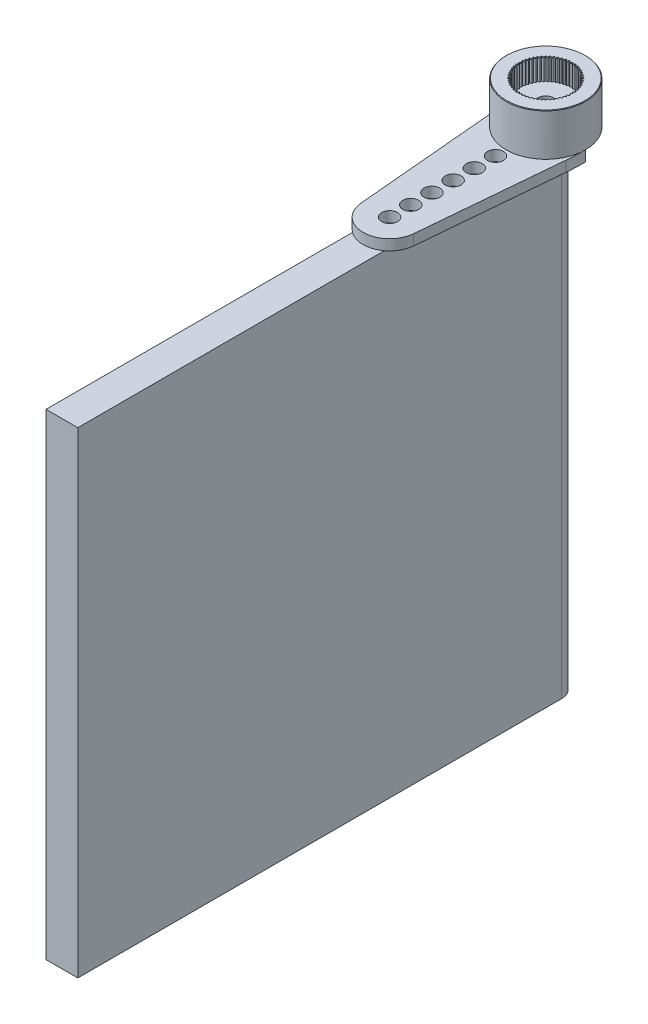
from build123d import *

# Parameters (mm, degrees)
IZIM1_R                     = 0.75
IZIM1_R_2                   = 3.75
Y_KSEKLIK_EKSTR_ZYON1_DEPTH = 1
IZIM2_R                     = 1.5
KES_EKSTR_ZYON1_DEPTH       = 1
IZIM2_3_R                   = 3.75
Y_KSEKLIK_EKSTR_ZYON2_DEPTH = 4
IZIM1_5_R                   = 0.75
KES_EKSTR_ZYON2_DEPTH       = 19.347343132
KES_EKSTR_ZYON3_START       = -2
IZIM3_R                     = 0.75
KES_EKSTR_ZYON3_DEPTH       = 2
PAH1_SIZE                   = 0.05
CORTAR_EXTRUIR1_DEPTH       = 1
SALIENTE_EXTRUIR7_DEPTH     = 45


with BuildPart() as part:
    # Çizim1 → Yükseklik-Ekstrüzyon1 (new body)
    # profile 1 of 3: a face of its own
    with BuildSketch(Plane(origin=(0, 0, 0), x_dir=(1, 0, 0), z_dir=(0, 1, 0))):
        with BuildLine():
            ThreePointArc((3.75, 0), (5e-09, -3.75), (-3.75, -1e-08))
            ThreePointArc((-3.75, -1e-08), (-3.730089845, -0.892193815), (-3.670399021, -1.782611249))
            Line((-3.670399021, -1.782611249), (-2.490049878, -14.972826406))
            ThreePointArc((-2.490049878, -14.972826406), (0, -17.25), (2.490049878, -14.972826406))
            Line((2.490049878, -14.972826406), (3.670399021, -1.782611249))
            ThreePointArc((3.670399021, -1.782611249), (3.730089845, -0.89219381), (3.75, 0))
        make_face()
        with Locations(Location((0, -14.75, 0), (0, 0, 270))):
            Circle(IZIM1_R, mode=Mode.SUBTRACT)
        with Locations(Location((0, -12.75, 0), (0, 0, 270))):
            Circle(IZIM1_R, mode=Mode.SUBTRACT)
        with Locations(Location((0, -10.75, 0), (0, 0, 270))):
            Circle(IZIM1_R, mode=Mode.SUBTRACT)
        with Locations(Location((0, -8.75, 0), (0, 0, 270))):
            Circle(IZIM1_R, mode=Mode.SUBTRACT)
        with Locations(Location((0, -6.75, 0), (0, 0, 270))):
            Circle(IZIM1_R, mode=Mode.SUBTRACT)
        with Locations(Location((0, -4.75, 0), (0, 0, 270))):
            Circle(IZIM1_R, mode=Mode.SUBTRACT)
    # profile 2 of 3: a face of its own
    with BuildSketch(Plane(origin=(0, 0, 0), x_dir=(1, 0, 0), z_dir=(0, 1, 0))):
        Circle(IZIM1_R_2)
        with Locations(Location((0, 0, 0), (0, 0, 270))):
            Circle(IZIM1_R, mode=Mode.SUBTRACT)
    # profile 3 of 3: a face of its own
    with BuildSketch(Plane(origin=(0, 0, 0), x_dir=(1, 0, 0), z_dir=(0, 1, 0))):
        with BuildLine():
            Line((-2.490049878, 14.972826406), (-3.670399021, 1.782611249))
            ThreePointArc((-3.670399021, 1.782611249), (-3.730089845, 0.892193805), (-3.75, -1e-08))
            ThreePointArc((-3.75, -1e-08), (-5e-09, 3.75), (3.75, 0))
            ThreePointArc((3.75, 0), (3.730089845, 0.89219381), (3.670399021, 1.782611249))
            Line((3.670399021, 1.782611249), (2.490049878, 14.972826406))
            ThreePointArc((2.490049878, 14.972826406), (0, 17.25), (-2.490049878, 14.972826406))
        make_face()
        with Locations(Location((0, 4.75, 0), (0, 0, 270))):
            Circle(IZIM1_R, mode=Mode.SUBTRACT)
        with Locations(Location((0, 6.75, 0), (0, 0, 270))):
            Circle(IZIM1_R, mode=Mode.SUBTRACT)
        with Locations(Location((0, 8.75, 0), (0, 0, 270))):
            Circle(IZIM1_R, mode=Mode.SUBTRACT)
        with Locations(Location((0, 10.75, 0), (0, 0, 270))):
            Circle(IZIM1_R, mode=Mode.SUBTRACT)
        with Locations(Location((0, 12.75, 0), (0, 0, 270))):
            Circle(IZIM1_R, mode=Mode.SUBTRACT)
        with Locations(Location((0, 14.75, 0), (0, 0, 270))):
            Circle(IZIM1_R, mode=Mode.SUBTRACT)
    extrude(amount=Y_KSEKLIK_EKSTR_ZYON1_DEPTH)

    # Çizim2 → Kes-Ekstrüzyon1 (cut)
    with BuildSketch(Plane(origin=(0, 1, 0), x_dir=(1, 0, 0), z_dir=(0, 1, 0))):
        with Locations(Location((0, 0, 0), (0, 0, 270))):
            Circle(IZIM2_R)
    extrude(amount=-KES_EKSTR_ZYON1_DEPTH, mode=Mode.SUBTRACT)

    # Çizim2<3> → Yükseklik-Ekstrüzyon2 (add)
    with BuildSketch(Plane(origin=(0, 1, 0), x_dir=(1, 0, 0), z_dir=(0, 1, 0))):
        with Locations(Location((0, 0, 0), (0, 0, 180))):
            Circle(IZIM2_3_R)
    extrude(amount=Y_KSEKLIK_EKSTR_ZYON2_DEPTH)

    # Çizim1<5> → Kes-Ekstrüzyon2 (cut, through all)
    with BuildSketch(Plane(origin=(0, 0, 0), x_dir=(1, 0, 0), z_dir=(0, 1, 0))):
        with Locations(Location((0, 0, 0), (0, 0, 270))):
            Circle(IZIM1_5_R)
    extrude(amount=KES_EKSTR_ZYON2_DEPTH, mode=Mode.SUBTRACT)

    # Çizim3 → Kes-Ekstrüzyon3 (cut)
    with BuildSketch(Plane(origin=(0, 5, 0), x_dir=(1, 0, 0), z_dir=(0, 1, 0)).offset(KES_EKSTR_ZYON3_START)):
        Polygon((0.132931704, 2.367068296), (0, 2.5), (-0.132931704, 2.367068296), (-0.27991119, 2.484280525), (-0.397123419, 2.337301039), (-0.556302335, 2.43731978), (-0.656321077, 2.278140865), (-0.825697655, 2.359708326), (-0.907265116, 2.190331748), (-1.084709348, 2.25242217), (-1.14679977, 2.074977938), (-1.330080191, 2.116810498), (-1.371912751, 1.933530077), (-1.558724505, 1.954578706), (-1.579773134, 1.767766953), (-1.767766953, 1.767766953), (-1.767766953, 1.579773134), (-1.954578706, 1.558724505), (-1.933530077, 1.371912751), (-2.116810498, 1.330080191), (-2.074977938, 1.14679977), (-2.25242217, 1.084709348), (-2.190331748, 0.907265116), (-2.359708326, 0.825697655), (-2.278140865, 0.656321077), (-2.43731978, 0.556302335), (-2.337301039, 0.397123419), (-2.484280525, 0.27991119), (-2.367068296, 0.132931704), (-2.5, 0), (-2.367068296, -0.132931704), (-2.484280525, -0.27991119), (-2.337301039, -0.397123419), (-2.43731978, -0.556302335), (-2.278140865, -0.656321077), (-2.359708326, -0.825697655), (-2.190331748, -0.907265116), (-2.25242217, -1.084709348), (-2.074977938, -1.14679977), (-2.116810498, -1.330080191), (-1.933530077, -1.371912751), (-1.954578706, -1.558724505), (-1.767766953, -1.579773134), (-1.767766953, -1.767766953), (-1.579773134, -1.767766953), (-1.558724505, -1.954578706), (-1.371912751, -1.933530077), (-1.330080191, -2.116810498), (-1.14679977, -2.074977938), (-1.084709348, -2.25242217), (-0.907265116, -2.190331748), (-0.825697655, -2.359708326), (-0.656321077, -2.278140865), (-0.556302335, -2.43731978), (-0.397123419, -2.337301039), (-0.27991119, -2.484280525), (-0.132931704, -2.367068296), (0, -2.5), (0.132931704, -2.367068296), (0.27991119, -2.484280525), (0.397123419, -2.337301039), (0.556302335, -2.43731978), (0.656321077, -2.278140865), (0.825697655, -2.359708326), (0.907265116, -2.190331748), (1.084709348, -2.25242217), (1.14679977, -2.074977938), (1.330080191, -2.116810498), (1.371912751, -1.933530077), (1.558724505, -1.954578706), (1.579773134, -1.767766953), (1.767766953, -1.767766953), (1.767766953, -1.579773134), (1.954578706, -1.558724505), (1.933530077, -1.371912751), (2.116810498, -1.330080191), (2.074977938, -1.14679977), (2.25242217, -1.084709348), (2.190331748, -0.907265116), (2.359708326, -0.825697655), (2.278140865, -0.656321077), (2.43731978, -0.556302335), (2.337301039, -0.397123419), (2.484280525, -0.27991119), (2.367068296, -0.132931704), (2.5, 0), (2.367068296, 0.132931704), (2.484280525, 0.27991119), (2.337301039, 0.397123419), (2.43731978, 0.556302335), (2.278140865, 0.656321077), (2.359708326, 0.825697655), (2.190331748, 0.907265116), (2.25242217, 1.084709348), (2.074977938, 1.14679977), (2.116810498, 1.330080191), (1.933530077, 1.371912751), (1.954578706, 1.558724505), (1.767766953, 1.579773134), (1.767766953, 1.767766953), (1.579773134, 1.767766953), (1.558724505, 1.954578706), (1.371912751, 1.933530077), (1.330080191, 2.116810498), (1.14679977, 2.074977938), (1.084709348, 2.25242217), (0.907265116, 2.190331748), (0.825697655, 2.359708326), (0.656321077, 2.278140865), (0.556302335, 2.43731978), (0.397123419, 2.337301039), (0.27991119, 2.484280525), align=None)
        Circle(IZIM3_R, mode=Mode.SUBTRACT)
    extrude(amount=KES_EKSTR_ZYON3_DEPTH, mode=Mode.SUBTRACT)

    # Pah1
    pah1_edges = [part.edges().sort_by_distance(p)[0] for p in [
        (-0.206421447, 5, -2.42567441),
        (0.066465852, 5, -2.433534148),
        (0.338517305, 5, -2.410790782),
        (0.606311706, 5, -2.357730323),
        (0.866481385, 5, -2.275020037),
        (1.115754559, 5, -2.163700054),
        (1.350996471, 5, -2.025170287),
        (1.569248819, 5, -1.86117283),
        (1.767766953, 5, -1.673770044),
        (1.944054391, 5, -1.465318628),
        (2.095894218, 5, -1.238439981),
        (2.221376959, 5, -0.995987232),
        (2.318924595, 5, -0.741009366),
        (2.38731041, 5, -0.476712877),
        (2.42567441, 5, -0.206421447),
        (2.433534148, 5, 0.066465852),
        (2.410790782, 5, 0.338517305),
        (2.357730323, 5, 0.606311706),
        (2.275020037, 5, 0.866481385),
        (2.163700054, 5, 1.115754559),
        (2.025170287, 5, 1.350996471),
        (1.86117283, 5, 1.569248819),
        (1.673770044, 5, 1.767766953),
        (1.465318628, 5, 1.944054391),
        (1.238439981, 5, 2.095894218),
        (0.995987232, 5, 2.221376959),
        (0.741009366, 5, 2.318924595),
        (0.476712877, 5, 2.38731041),
        (0.206421447, 5, 2.42567441),
        (-0.066465852, 5, 2.433534148),
        (-0.338517305, 5, 2.410790782),
        (-0.606311706, 5, 2.357730323),
        (-0.866481385, 5, 2.275020037),
        (-1.115754559, 5, 2.163700054),
        (-1.350996471, 5, 2.025170287),
        (-1.569248819, 5, 1.86117283),
        (-1.767766953, 5, 1.673770044),
        (-1.944054391, 5, 1.465318628),
        (-2.095894218, 5, 1.238439981),
        (-2.221376959, 5, 0.995987232),
        (-2.318924595, 5, 0.741009366),
        (-2.38731041, 5, 0.476712877),
        (-2.42567441, 5, 0.206421447),
        (-2.433534148, 5, -0.066465852),
        (-2.410790782, 5, -0.338517305),
        (-2.357730323, 5, -0.606311706),
        (-2.275020037, 5, -0.866481385),
        (-2.163700054, 5, -1.115754559),
        (-2.025170287, 5, -1.350996471),
        (-1.86117283, 5, -1.569248819),
        (-1.673770044, 5, -1.767766953),
        (-1.465318628, 5, -1.944054391),
        (-1.238439981, 5, -2.095894218),
        (-0.995987232, 5, -2.221376959),
        (-0.741009366, 5, -2.318924595),
        (-0.476712877, 5, -2.38731041),
        (-0.338517305, 5, -2.410790782),
        (-0.606311706, 5, -2.357730323),
        (-0.866481385, 5, -2.275020037),
        (-1.115754559, 5, -2.163700054),
        (-1.350996471, 5, -2.025170287),
        (-1.569248819, 5, -1.86117283),
        (-1.767766953, 5, -1.673770044),
        (-1.944054391, 5, -1.465318628),
        (-2.095894218, 5, -1.238439981),
        (-2.221376959, 5, -0.995987232),
        (-2.318924595, 5, -0.741009366),
        (-2.38731041, 5, -0.476712877),
        (-2.42567441, 5, -0.206421447),
        (-2.433534148, 5, 0.066465852),
        (-2.410790782, 5, 0.338517305),
        (-2.357730323, 5, 0.606311706),
        (-2.275020037, 5, 0.866481385),
        (-2.163700054, 5, 1.115754559),
        (-2.025170287, 5, 1.350996471),
        (-1.86117283, 5, 1.569248819),
        (-1.673770044, 5, 1.767766953),
        (-1.465318628, 5, 1.944054391),
        (-1.238439981, 5, 2.095894218),
        (-0.995987232, 5, 2.221376959),
        (-0.741009366, 5, 2.318924595),
        (-0.476712877, 5, 2.38731041),
        (-0.206421447, 5, 2.42567441),
        (0.066465852, 5, 2.433534148),
        (0.338517305, 5, 2.410790782),
        (0.606311706, 5, 2.357730323),
        (0.866481385, 5, 2.275020037),
        (1.115754559, 5, 2.163700054),
        (1.350996471, 5, 2.025170287),
        (1.569248819, 5, 1.86117283),
        (1.767766953, 5, 1.673770044),
        (1.944054391, 5, 1.465318628),
        (2.095894218, 5, 1.238439981),
        (2.221376959, 5, 0.995987232),
        (2.318924595, 5, 0.741009366),
        (2.38731041, 5, 0.476712877),
        (2.42567441, 5, 0.206421447),
        (2.433534148, 5, -0.066465852),
        (2.410790782, 5, -0.338517305),
        (2.357730323, 5, -0.606311706),
        (2.275020037, 5, -0.866481385),
        (2.163700054, 5, -1.115754559),
        (2.025170287, 5, -1.350996471),
        (1.86117283, 5, -1.569248819),
        (1.673770044, 5, -1.767766953),
        (1.465318628, 5, -1.944054391),
        (1.238439981, 5, -2.095894218),
        (0.995987232, 5, -2.221376959),
        (0.741009366, 5, -2.318924595),
        (0.476712877, 5, -2.38731041),
        (0.206421447, 5, -2.42567441),
        (-0.066465852, 5, -2.433534148),
        (3.75, 5, 0),
    ]]
    chamfer(pah1_edges, length=PAH1_SIZE)

    # Croquis1 → Cortar-Extruir1 (cut)
    with BuildSketch(Plane.XZ):
        Polygon((-7.858117829, -1.864023902), (-7.858117829, -21.734130285), (7.822490159, -21.734130285), (7.822490159, -1.864023902), (3.75, 0), (-0.017813835, -1.864023902), (-3.75, 0), align=None)
    extrude(amount=-CORTAR_EXTRUIR1_DEPTH, mode=Mode.SUBTRACT)


with BuildPart() as body_2:
    # Croquis3 → Saliente-Extruir7 (new body)
    with BuildSketch(Plane.XZ):
        with BuildLine():
            Line((-1.5, 0), (-1.5, 45.687829235))
            Line((-1.5, 45.687829235), (1.5, 45.687829235))
            Line((1.5, 45.687829235), (1.5, 0))
            ThreePointArc((1.5, 0), (0, -1.5), (-1.5, 0))
        make_face()
    extrude(amount=SALIENTE_EXTRUIR7_DEPTH)


solid = Compound([part.part, body_2.part])
